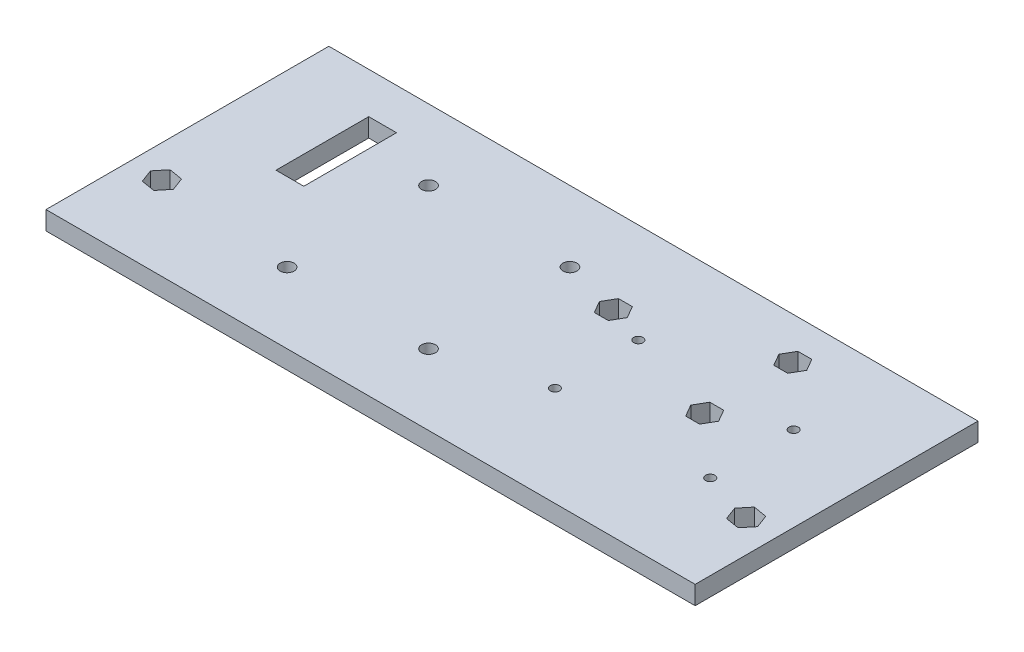
from build123d import *

# Parameters (mm, degrees)
SKETCH1_W           = 140
SKETCH1_H           = 61
BOSS_EXTRUDE1_DEPTH = 4
SKETCH2_W           = 6
SKETCH2_H           = 20
CUT_EXTRUDE1_DEPTH  = 10
SKETCH4_3_R         = 1
SKETCH4_3_R_2       = 1.5
CUT_EXTRUDE3_DEPTH  = 4
CUT_EXTRUDE4_DEPTH  = 34
CUT_EXTRUDE5_DEPTH  = 10


with BuildPart() as part:
    # Sketch1 → Boss-Extrude1 (new body)
    with BuildSketch(Plane(origin=(0, 0, 0), x_dir=(1, 0, 0), z_dir=(0, 1, 0))):
        with Locations((70, 0)):
            Rectangle(SKETCH1_W, SKETCH1_H)
    extrude(amount=BOSS_EXTRUDE1_DEPTH)

    # Sketch2 → Cut-Extrude1 (cut)
    with BuildSketch(Plane(origin=(0, 4, 0), x_dir=(1, 0, 0), z_dir=(0, 1, 0))):
        with Locations((20.449723582, 11.650059082)):
            Rectangle(SKETCH2_W, SKETCH2_H)
    extrude(amount=-CUT_EXTRUDE1_DEPTH, mode=Mode.SUBTRACT)

    # Sketch4<3> → Cut-Extrude3 (cut)
    with BuildSketch(Plane.XZ):
        with Locations((88.25, -9)):
            Circle(SKETCH4_3_R)
        with Locations((88.25, 9)):
            Circle(SKETCH4_3_R)
        with Locations((121.75, -9)):
            Circle(SKETCH4_3_R)
        with Locations((121.75, 9)):
            Circle(SKETCH4_3_R)
        with Locations((36.75, 15.25)):
            Circle(SKETCH4_3_R_2)
        with Locations((67.25, 15.25)):
            Circle(SKETCH4_3_R_2)
        with Locations((67.25, -15.25)):
            Circle(SKETCH4_3_R_2)
        with Locations((36.75, -15.25)):
            Circle(SKETCH4_3_R_2)
    extrude(amount=-CUT_EXTRUDE3_DEPTH, mode=Mode.SUBTRACT)

    # Sketch6 → Cut-Extrude4 (cut)
    with BuildSketch(Plane(origin=(0, 4, 0), x_dir=(1, 0, 0), z_dir=(0, 1, 0))):
        Polygon((81.358539738, 14.6), (78.356318338, 14.6), (76.855207639, 12), (78.356318338, 9.4), (81.358539738, 9.4), (82.859650438, 12), align=None)
        Polygon((110.558539738, 5.1), (107.556318338, 5.1), (106.055207639, 2.5), (107.556318338, -0.1), (110.558539738, -0.1), (112.059650438, 2.5), align=None)
        Polygon((112.059650438, 21.5), (110.558539738, 24.1), (107.556318338, 24.1), (106.055207639, 21.5), (107.556318338, 18.9), (110.558539738, 18.9), align=None)
    extrude(amount=-CUT_EXTRUDE4_DEPTH, mode=Mode.SUBTRACT)

    # Sketch7 → Cut-Extrude5 (cut)
    with BuildSketch(Plane(origin=(0, 4, 0), x_dir=(1, 0, 0), z_dir=(0, 1, 0))):
        Polygon((9.961432148, -12.993206821), (8.90784571, -10.181927939), (5.946413563, -9.688721118), (4.038567852, -12.006793179), (5.09215429, -14.818072061), (8.053586437, -15.311278882), align=None)
        Polygon((135.961432148, -12.993206821), (134.90784571, -10.181927939), (131.946413563, -9.688721118), (130.038567852, -12.006793179), (131.09215429, -14.818072061), (134.053586437, -15.311278882), align=None)
    extrude(amount=-CUT_EXTRUDE5_DEPTH, mode=Mode.SUBTRACT)


solid = part.part
